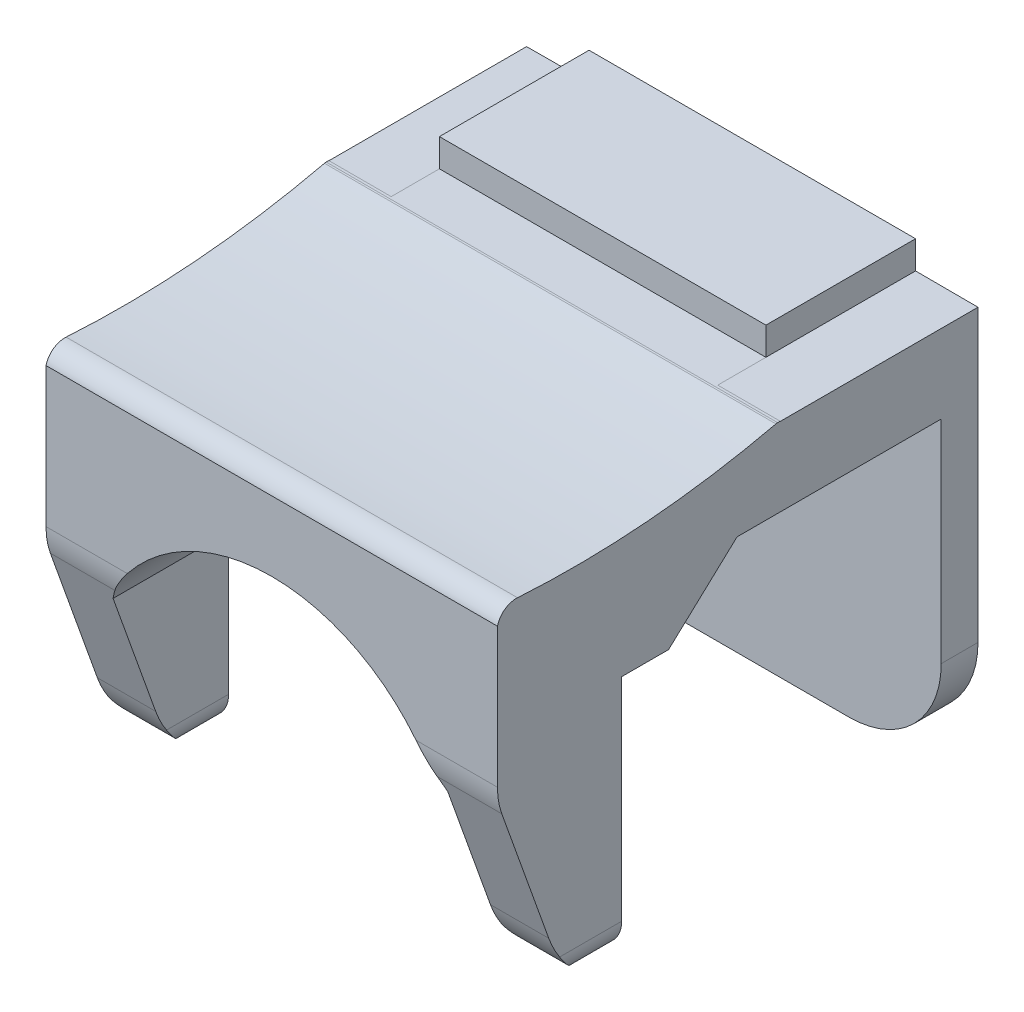
from build123d import *

# Parameters (mm, degrees)
BOSS_EXTRUDE2_DEPTH = 17.8
CUT_EXTRUDE1_DEPTH  = 15.6
CUT_EXTRUDE2_DEPTH  = 15.6


with BuildPart() as part:
    # Sketch2 → Boss-Extrude2 (new, symmetric)
    with BuildSketch(Plane(origin=(0, 0, 0), x_dir=(0, 0, -1), z_dir=(1, 0, 0))):
        with BuildLine():
            Line((0, 15.50389008), (-11.8, 15.50389008))
            Line((-11.8, 15.50389008), (-11.8, 13.30389008))
            Line((-11.8, 13.30389008), (-15.8, 13.30389008))
            ThreePointArc((-15.8, 13.30389008), (-15.869442202, 13.299917081), (-15.937978141, 13.288049932))
            ThreePointArc((-15.937978141, 13.288049932), (-26.064403897, 11.700216575), (-36.314108018, 11.60389008))
            ThreePointArc((-36.314108018, 11.60389008), (-37.313669561, 11.31470673), (-37.9, 10.455074886))
            Line((-37.9, 10.455074886), (-37.9, -0.544925114))
            ThreePointArc((-37.9, -0.544925114), (-37.813111141, -1.55413735), (-37.555001853, -2.533646721))
            Line((-37.555001853, -2.533646721), (-33.85, -12.890912831))
            ThreePointArc((-33.85, -12.890912831), (-32.58061565, -15.162493454), (-30.64, -16.89610992))
            Line((-30.64, -16.89610992), (-28.1, -16.89610992))
            Line((-28.1, -16.89610992), (-28.1, 2.10389008))
            Line((-28.1, 2.10389008), (-24.4, 2.10389008))
            Line((-24.4, 2.10389008), (-19, 7.10389008))
            Line((-19, 7.10389008), (-2.9, 7.10389008))
            Line((-2.9, 7.10389008), (-2.9, -16.89610992))
            Line((-2.9, -16.89610992), (0, -16.89610992))
            Line((0, -16.89610992), (0, 15.50389008))
        make_face()
    extrude(amount=BOSS_EXTRUDE2_DEPTH, both=True)

    # Sketch3 → Cut-Extrude1 (cut)
    with BuildSketch(Plane.XY.offset(37.9)):
        with BuildLine():
            Line((-13.2, -14.59610992), (-13.2, -16.89610992))
            Line((-13.2, -16.89610992), (13.2, -16.89610992))
            Line((13.2, -16.89610992), (13.2, -14.59610992))
            Line((13.2, -14.59610992), (13.2, -3.49610992))
            ThreePointArc((13.2, -3.49610992), (12.380923678, -1.966255492), (11.385353215, -0.544925114))
            Line((11.385353215, -0.544925114), (-11.385353215, -0.544925114))
            ThreePointArc((-11.385353215, -0.544925114), (-12.380923678, -1.966255492), (-13.2, -3.49610992))
            Line((-13.2, -3.49610992), (-13.2, -14.59610992))
        make_face()
        with BuildLine():
            ThreePointArc((0, 4.955074886), (-6.322109375, 3.508041139), (-11.385353215, -0.544925114))
            Line((-11.385353215, -0.544925114), (11.385353215, -0.544925114))
            ThreePointArc((11.385353215, -0.544925114), (6.322109375, 3.508041139), (0, 4.955074886))
        make_face()
        with BuildLine():
            Line((-15.5, -16.89610992), (-13.2, -16.89610992))
            Line((-13.2, -16.89610992), (-13.2, -14.59610992))
            ThreePointArc((-13.2, -14.59610992), (-13.873654403, -16.222455516), (-15.5, -16.89610992))
        make_face()
        with BuildLine():
            Line((-17.8, -16.89610992), (-15.5, -16.89610992))
            ThreePointArc((-15.5, -16.89610992), (-17.126345597, -16.222455516), (-17.8, -14.59610992))
            Line((-17.8, -14.59610992), (-17.8, -16.89610992))
        make_face()
        with BuildLine():
            Line((13.2, -14.59610992), (13.2, -16.89610992))
            Line((13.2, -16.89610992), (15.5, -16.89610992))
            ThreePointArc((15.5, -16.89610992), (13.873654403, -16.222455516), (13.2, -14.59610992))
        make_face()
        with BuildLine():
            ThreePointArc((17.8, -14.59610992), (17.126345597, -16.222455516), (15.5, -16.89610992))
            Line((15.5, -16.89610992), (17.8, -16.89610992))
            Line((17.8, -16.89610992), (17.8, -14.59610992))
        make_face()
    extrude(amount=-CUT_EXTRUDE1_DEPTH, mode=Mode.SUBTRACT)

    # Sketch4 → Cut-Extrude2 (cut)
    with BuildSketch(Plane.XY):
        Polygon((-12.875, 15.50389008), (-12.875, 13.30389008), (-17.8, 13.288049932), (-17.8, 15.50389008), align=None)
        Polygon((12.875, 15.50389008), (17.8, 15.50389008), (17.8, 13.288049932), (12.875, 13.30389008), align=None)
        with BuildLine():
            Line((17.8, -9.604528344), (17.8, -16.89610992))
            Line((17.8, -16.89610992), (10.508418424, -16.89610992))
            ThreePointArc((10.508418424, -16.89610992), (15.664345202, -14.760455122), (17.8, -9.604528344))
        make_face()
        with BuildLine():
            Line((-17.8, -9.604528344), (-17.8, -16.89610992))
            Line((-17.8, -16.89610992), (-10.508418424, -16.89610992))
            ThreePointArc((-10.508418424, -16.89610992), (-15.664345202, -14.760455122), (-17.8, -9.604528344))
        make_face()
    extrude(amount=CUT_EXTRUDE2_DEPTH, mode=Mode.SUBTRACT)


solid = part.part
